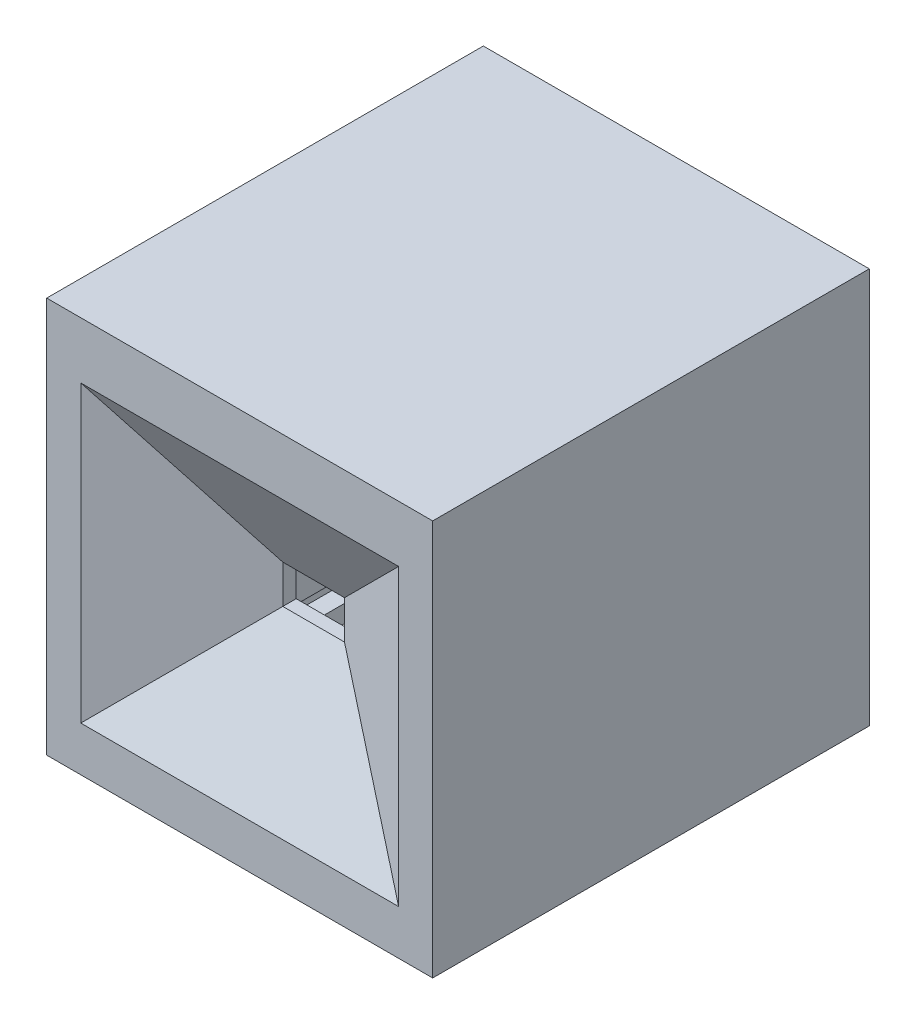
from build123d import *

# Parameters (mm, degrees)
SKETCH2_W           = 33.15
SKETCH2_H           = 33
BOSS_EXTRUDE1_DEPTH = 7.5
SKETCH3_R           = 1.175
CUT_EXTRUDE1_DEPTH  = 4.5
SKETCH4_W           = 5.3
SKETCH4_H           = 7
CUT_EXTRUDE2_DEPTH  = 3.5
SKETCH5_W           = 17.312690108
SKETCH5_H           = 1.808425299
CUT_EXTRUDE3_DEPTH  = 2
SKETCH6_W           = 5.3
SKETCH6_H           = 3.3
CUT_EXTRUDE4_DEPTH  = 25.560753755
CHAMFER3_SIZE       = 11
CHAMFER3_SIZE2      = 6.350852961
SKETCH7_W           = 3
SKETCH7_H           = 33
SKETCH7_H_2         = 30
BOSS_EXTRUDE2_DEPTH = 30
SKETCH8_W           = 33.15
SKETCH8_H           = 37.5
BOSS_EXTRUDE3_DEPTH = 1
SKETCH9_W           = 1.5
SKETCH9_H           = 2
CUT_EXTRUDE5_DEPTH  = 31.5
SKETCH10_W          = 27.15
SKETCH10_H          = 2
CUT_EXTRUDE6_DEPTH  = 1.5
CUT_EXTRUDE7_START  = -30
SKETCH11_W          = 1.5
SKETCH11_H          = 2
CUT_EXTRUDE7_DEPTH  = 30
SKETCH14_W          = 30.15
SKETCH14_H          = 2
CUT_EXTRUDE8_DEPTH  = 1.5


with BuildPart() as part:
    # Sketch2 → Boss-Extrude1 (new body)
    with BuildSketch(Plane.XY):
        Rectangle(SKETCH2_W, SKETCH2_H)
    extrude(amount=BOSS_EXTRUDE1_DEPTH)

    # Sketch3 → Cut-Extrude1 (cut)
    with BuildSketch(Plane.XY):
        with Locations((10.325, 10.25)):
            Circle(SKETCH3_R)
        with Locations((-10.325, 10.25)):
            Circle(SKETCH3_R)
        with Locations((10.325, -10.25)):
            Circle(SKETCH3_R)
        with Locations((-10.325, -10.25)):
            Circle(SKETCH3_R)
    extrude(amount=CUT_EXTRUDE1_DEPTH, mode=Mode.SUBTRACT)

    # Sketch4 → Cut-Extrude2 (cut)
    with BuildSketch(Plane.XY):
        with Locations((9.775, 0)):
            Rectangle(SKETCH4_W, SKETCH4_H)
        with Locations((-9.775, 0)):
            Rectangle(SKETCH4_W, SKETCH4_H)
    extrude(amount=CUT_EXTRUDE2_DEPTH, mode=Mode.SUBTRACT)

    # Sketch5 → Cut-Extrude3 (cut)
    with BuildSketch(Plane.XY):
        with Locations((-0.109621432, -11.80915301)):
            Rectangle(SKETCH5_W, SKETCH5_H)
    extrude(amount=CUT_EXTRUDE3_DEPTH, mode=Mode.SUBTRACT)

    # Sketch6 → Cut-Extrude4 (cut, through all)
    with BuildSketch(Plane.XY):
        Rectangle(SKETCH6_W, SKETCH6_H)
    extrude(amount=CUT_EXTRUDE4_DEPTH, mode=Mode.SUBTRACT)

    # Chamfer3
    chamfer3_edges = [part.edges().sort_by_distance(p)[0] for p in [
        (2.65, 0, 7.5),
        (0, 1.65, 7.5),
        (-2.65, 0, 7.5),
        (0, -1.65, 7.5),
    ]]
    chamfer3_side = [part.faces().sort_by_distance(p)[0] for p in [
        (-16.107247662, 0, 7.5),
    ]]
    chamfer(chamfer3_edges, length=CHAMFER3_SIZE, length2=CHAMFER3_SIZE2, reference=chamfer3_side[0])

    # Sketch7 → Boss-Extrude2 (add)
    with BuildSketch(Plane.XY):
        with Locations((15.075, 0)):
            Rectangle(SKETCH7_W, SKETCH7_H)
        Polygon((-13.575, 13.5), (13.575, 13.5), (13.575, 16.5), (-16.575, 16.5), (-16.575, 13.5), align=None)
        with Locations((-15.075, -1.5)):
            Rectangle(SKETCH7_W, SKETCH7_H_2)
    extrude(amount=-BOSS_EXTRUDE2_DEPTH)

    # Sketch8 → Boss-Extrude3 (add)
    with BuildSketch(Plane(origin=(0, 16.5, 0), x_dir=(1, 0, 0), z_dir=(0, 1, 0))):
        with Locations((0, 11.25)):
            Rectangle(SKETCH8_W, SKETCH8_H)
    extrude(amount=BOSS_EXTRUDE3_DEPTH)

    # Sketch9 → Cut-Extrude5 (cut)
    with BuildSketch(Plane.XZ.offset(16.5)):
        with Locations((-14.325, -27)):
            Rectangle(SKETCH9_W, SKETCH9_H)
        with Locations((14.325, -27)):
            Rectangle(SKETCH9_W, SKETCH9_H)
    extrude(amount=-CUT_EXTRUDE5_DEPTH, mode=Mode.SUBTRACT)

    # Sketch10 → Cut-Extrude6 (cut)
    with BuildSketch(Plane.XZ.offset(-13.5)):
        with Locations((0, -27)):
            Rectangle(SKETCH10_W, SKETCH10_H)
    extrude(amount=-CUT_EXTRUDE6_DEPTH, mode=Mode.SUBTRACT)

    # Sketch11 → Cut-Extrude7 (cut)
    with BuildSketch(Plane(origin=(0, 0, -30), x_dir=(-1, 0, 0), z_dir=(0, 0, -1)).offset(CUT_EXTRUDE7_START)):
        with Locations((-14.325, -14)):
            Rectangle(SKETCH11_W, SKETCH11_H)
        with Locations((14.325, -14)):
            Rectangle(SKETCH11_W, SKETCH11_H)
    extrude(amount=CUT_EXTRUDE7_DEPTH, mode=Mode.SUBTRACT)

    # Sketch14 → Cut-Extrude8 (cut)
    with BuildSketch(Plane(origin=(0, 0, 0), x_dir=(-1, 0, 0), z_dir=(0, 0, -1))):
        with Locations((0, -14)):
            Rectangle(SKETCH14_W, SKETCH14_H)
    extrude(amount=-CUT_EXTRUDE8_DEPTH, mode=Mode.SUBTRACT)


solid = part.part
